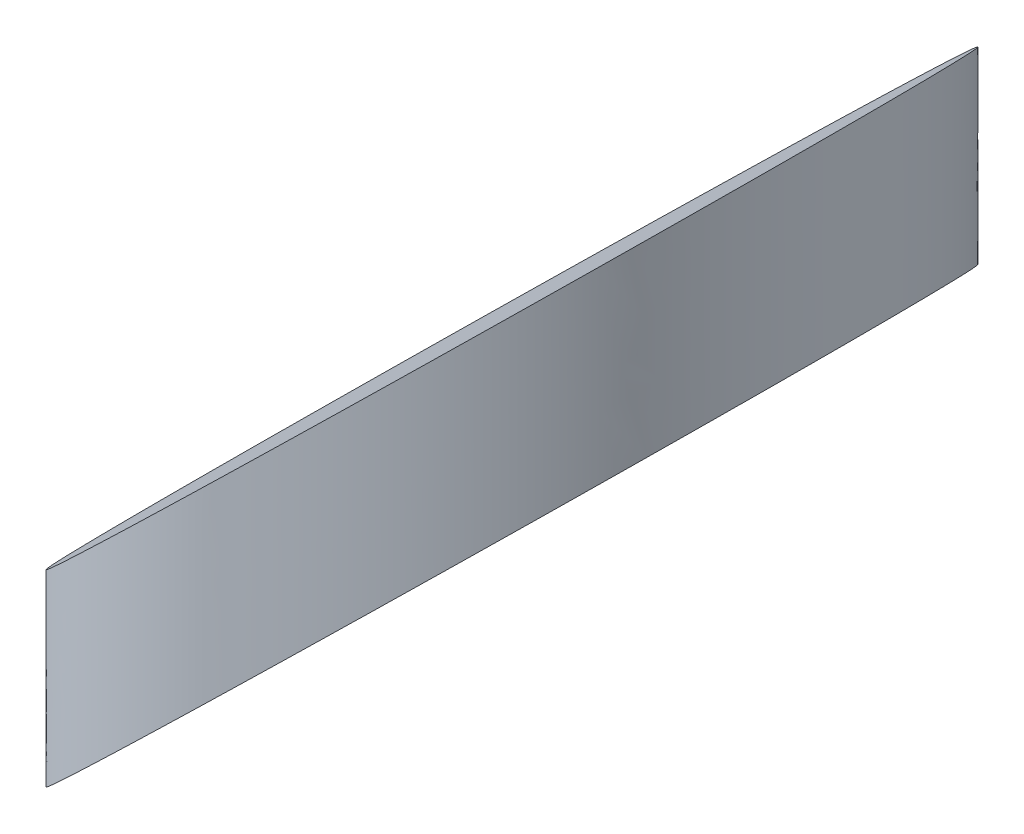
from build123d import *

# Parameters (mm, degrees)
SKETCH_3_RX              = 17.5
SKETCH_3_RY              = 17.5
EXTRUDE_2_DEPTH          = 44
CUT_EXTRUDE_2_DEPTH      = 51.482670294
CUT_EXTRUDE_2_DEPTH_BACK = 51.482670294


with BuildPart() as part:
    # Эскиз3 → Бобышка-Вытянуть2 (new body)
    with BuildSketch(Plane(origin=(0, 0, 0), x_dir=(1, 0, 0), z_dir=(0, 1, 0))):
        with Locations(Location((0, 0), (0, 0, 0))):
            Ellipse(SKETCH_3_RX, SKETCH_3_RY)
    extrude(amount=EXTRUDE_2_DEPTH)

    # Эскиз4 → Вырез-Вытянуть2 (cut, two sides: drawn at the far end of the back side and taken through both)
    with BuildSketch(Plane.XY.offset(-CUT_EXTRUDE_2_DEPTH_BACK)):
        Polygon((-17.5, 44), (17.5, 44), (-17.5, 10), align=None)
        Polygon((17.5, 0), (-17.5, 0), (17.5, 34), align=None)
    extrude(amount=CUT_EXTRUDE_2_DEPTH + CUT_EXTRUDE_2_DEPTH_BACK, mode=Mode.SUBTRACT)


solid = part.part
